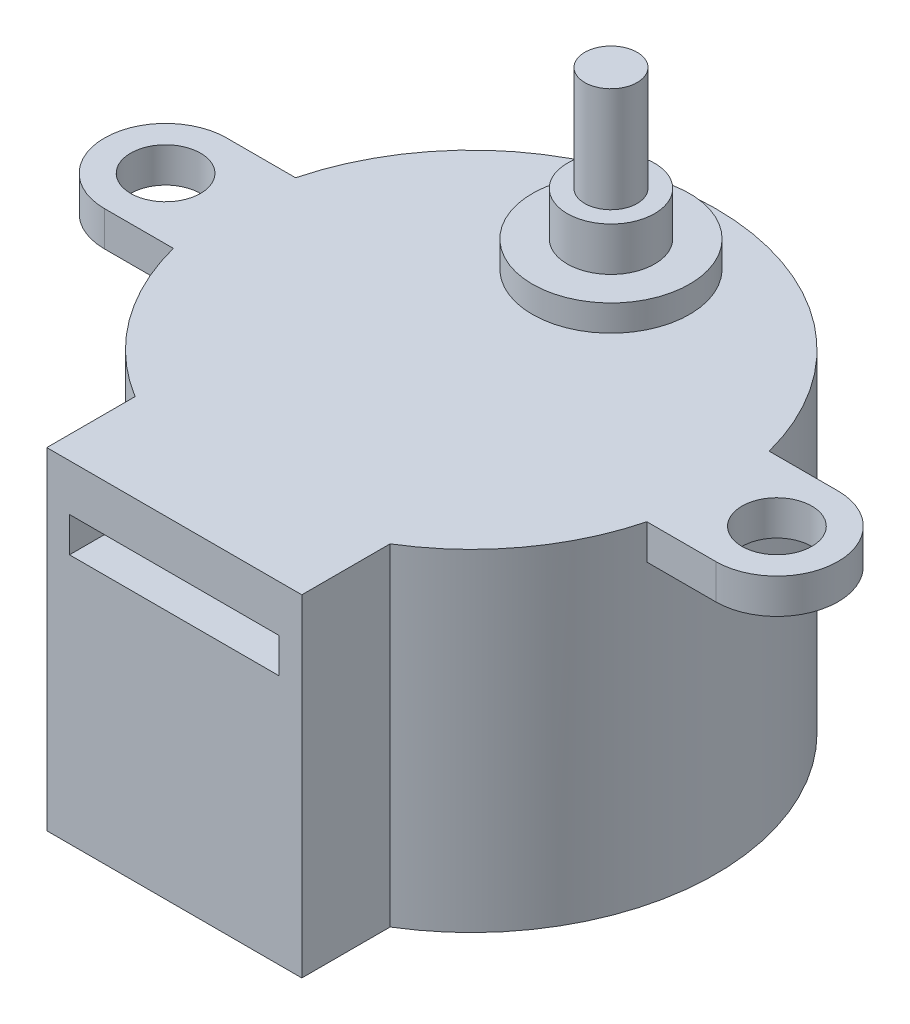
from build123d import *

# Parameters (mm, degrees)
SKETCH1_R           = 14
BOSS_EXTRUDE1_DEPTH = 19
BOSS_EXTRUDE2_START = -2
SKETCH4_R           = 2
BOSS_EXTRUDE2_DEPTH = 2
SKETCH5_R           = 4.5
BOSS_EXTRUDE3_DEPTH = 1.5
SKETCH6_R           = 2.5
BOSS_EXTRUDE4_DEPTH = 2.5
SKETCH7_R           = 1.5
BOSS_EXTRUDE5_DEPTH = 6
SKETCH8_W           = 12
SKETCH8_H           = 2
CUT_EXTRUDE1_DEPTH  = 4


with BuildPart() as part:
    # Sketch1 → Boss-Extrude1 (new body)
    with BuildSketch(Plane(origin=(0, 0, 0), x_dir=(1, 0, 0), z_dir=(0, 1, 0))):
        Circle(SKETCH1_R)
        with BuildLine():
            Line((-7.3, -11.94612908), (-7.3, -17))
            Line((-7.3, -17), (0, -17))
            Line((0, -17), (7.3, -17))
            Line((7.3, -17), (7.3, -11.94612908))
            ThreePointArc((7.3, -11.94612908), (0, -14), (-7.3, -11.94612908))
        make_face()
    extrude(amount=BOSS_EXTRUDE1_DEPTH)

    # Sketch4 → Boss-Extrude2 (add)
    # profile 1 of 2: a face of its own
    with BuildSketch(Plane(origin=(0, 19, 0), x_dir=(1, 0, 0), z_dir=(0, 1, 0)).offset(BOSS_EXTRUDE2_START)):
        with BuildLine():
            ThreePointArc((-17.5, 3.5), (-21, 0), (-17.5, -3.5))
            Line((-17.5, -3.5), (-13.555441712, -3.5))
            ThreePointArc((-13.555441712, -3.5), (-14, 0), (-13.555441712, 3.5))
            Line((-13.555441712, 3.5), (-17.5, 3.5))
        make_face()
        with Locations(Location((-17.5, 0, 0), (0, 0, 270))):
            Circle(SKETCH4_R, mode=Mode.SUBTRACT)
    # profile 2 of 2: a face of its own
    with BuildSketch(Plane(origin=(0, 19, 0), x_dir=(1, 0, 0), z_dir=(0, 1, 0)).offset(BOSS_EXTRUDE2_START)):
        with BuildLine():
            Line((17.5, 3.5), (13.555441712, 3.5))
            ThreePointArc((13.555441712, 3.5), (14, 0), (13.555441712, -3.5))
            Line((13.555441712, -3.5), (17.5, -3.5))
            ThreePointArc((17.5, -3.5), (21, 0), (17.5, 3.5))
        make_face()
        with Locations(Location((17.5, 0, 0), (0, 0, 270))):
            Circle(SKETCH4_R, mode=Mode.SUBTRACT)
    extrude(amount=BOSS_EXTRUDE2_DEPTH)

    # Sketch5 → Boss-Extrude3 (add)
    with BuildSketch(Plane(origin=(0, 19, 0), x_dir=(1, 0, 0), z_dir=(0, 1, 0))):
        with Locations(Location((0, 8, 0), (0, 0, 270))):
            Circle(SKETCH5_R)
    extrude(amount=BOSS_EXTRUDE3_DEPTH)

    # Sketch6 → Boss-Extrude4 (add)
    with BuildSketch(Plane(origin=(0, 20.5, 0), x_dir=(1, 0, 0), z_dir=(0, 1, 0))):
        with Locations(Location((0, 8, 0), (0, 0, 270))):
            Circle(SKETCH6_R)
    extrude(amount=BOSS_EXTRUDE4_DEPTH)

    # Sketch7 → Boss-Extrude5 (add)
    with BuildSketch(Plane(origin=(0, 23, 0), x_dir=(1, 0, 0), z_dir=(0, 1, 0))):
        with Locations(Location((0, 8, 0), (0, 0, 270))):
            Circle(SKETCH7_R)
    extrude(amount=BOSS_EXTRUDE5_DEPTH)

    # Sketch8 → Cut-Extrude1 (cut)
    with BuildSketch(Plane.XY.offset(17)):
        with Locations((0, 15.332469826)):
            Rectangle(SKETCH8_W, SKETCH8_H)
    extrude(amount=-CUT_EXTRUDE1_DEPTH, mode=Mode.SUBTRACT)


solid = part.part
